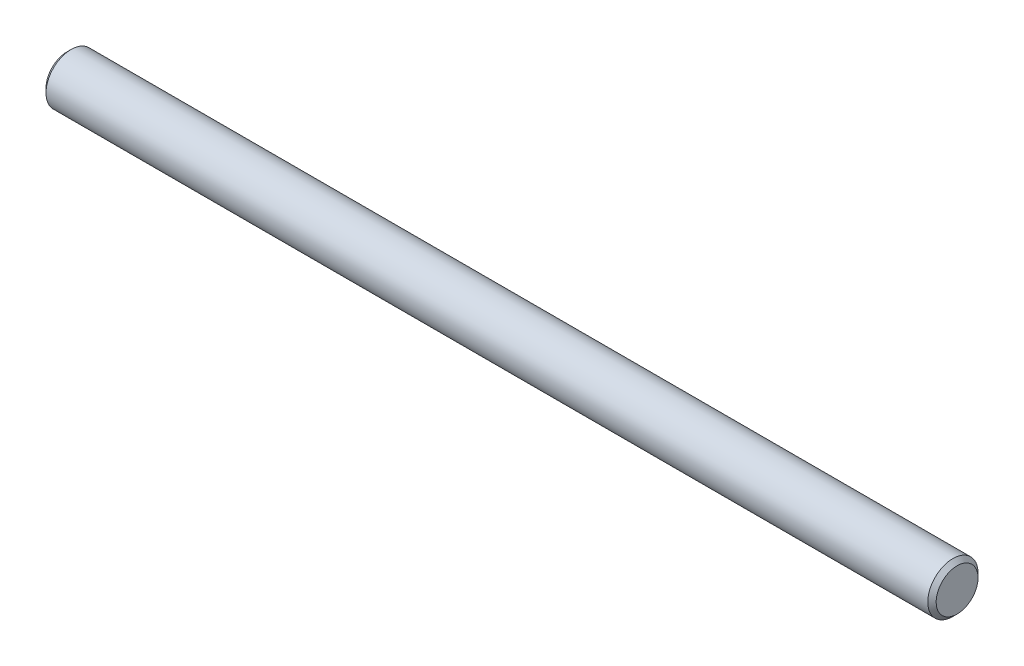
from build123d import *


with BuildPart() as part:
    # ｽｹｯﾁ1 → 回転1 (revolve)
    with BuildSketch(Plane(origin=(0, 0, 0), x_dir=(-1, 0, 0), z_dir=(0, 0, -1)), mode=Mode.PRIVATE) as revolve_1_sk:
        Polygon((-146.006944444, 2.517361111), (-146.006944444, 0), (-39, 0), (-39, 2.517361111), (-39.503472222, 3.020833333), (-145.503472222, 3.020833333), align=None)
    revolve(revolve_1_sk.sketch.rotate(Axis((146.006944444, 0, 0), (-1, 0, 0)), 270), axis=Axis((146.006944444, 0, 0), (-1, 0, 0)))


solid = part.part
